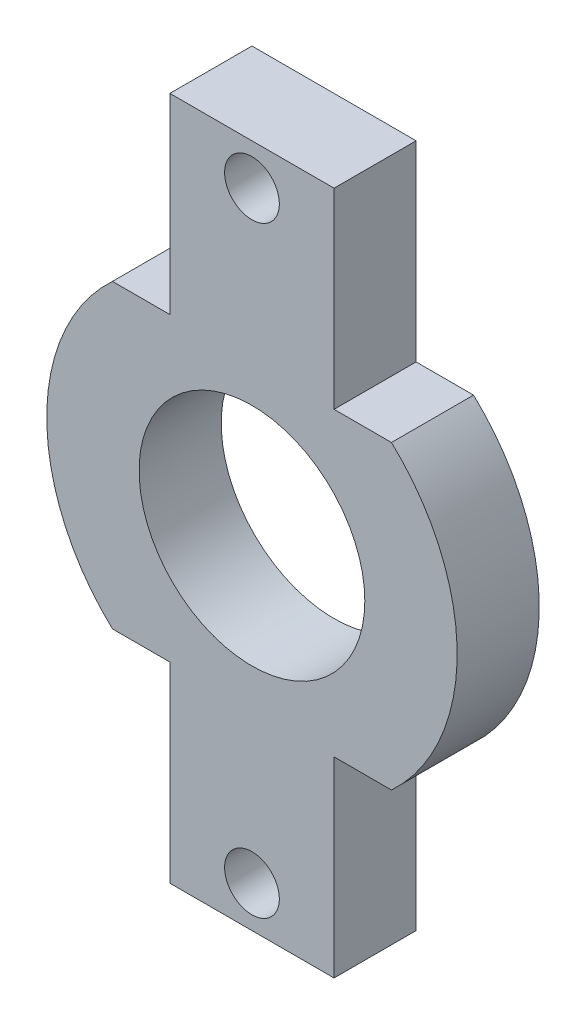
from build123d import *

# Parameters (mm, degrees)
SKETCH1_R           = 8.25
BOSS_EXTRUDE1_DEPTH = 6
SKETCH3_R           = 2
CUT_EXTRUDE1_DEPTH  = 30.765752132


with BuildPart() as part:
    # Sketch1 → Boss-Extrude1 (new body)
    with BuildSketch(Plane.XY):
        with BuildLine():
            Line((6, -25), (6, -11))
            Line((6, -11), (10.198039027, -11))
            ThreePointArc((10.198039027, -11), (15, 0), (10.198039027, 11))
            Line((10.198039027, 11), (6, 11))
            Line((6, 11), (6, 25))
            Line((6, 25), (-6, 25))
            Line((-6, 25), (-6, 11))
            Line((-6, 11), (-10.198039027, 11))
            ThreePointArc((-10.198039027, 11), (-15, 0), (-10.198039027, -11))
            Line((-10.198039027, -11), (-6, -11))
            Line((-6, -11), (-6, -25))
            Line((-6, -25), (6, -25))
        make_face()
        Circle(SKETCH1_R, mode=Mode.SUBTRACT)
    extrude(amount=BOSS_EXTRUDE1_DEPTH)

    # Sketch3 → Cut-Extrude1 (cut, through all)
    with BuildSketch(Plane(origin=(0, 0, 0), x_dir=(-1, 0, 0), z_dir=(0, 0, -1))):
        with Locations((0, 22)):
            Circle(SKETCH3_R)
        with Locations((0, -22)):
            Circle(SKETCH3_R)
    extrude(amount=-CUT_EXTRUDE1_DEPTH, mode=Mode.SUBTRACT)


solid = part.part
